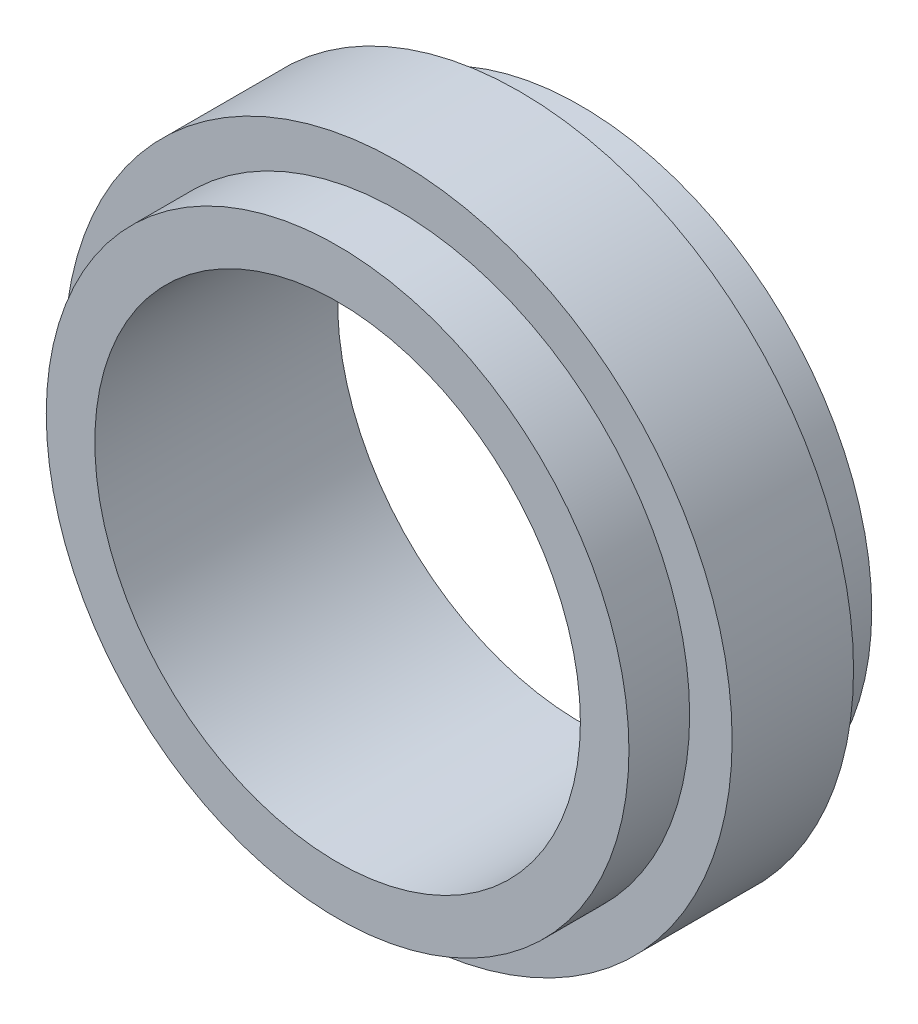
from build123d import *

# Parameters (mm, degrees)
SKETCH1_R           = 27.5
SKETCH1_R_2         = 20
BOSS_EXTRUDE1_DEPTH = 5
SKETCH2_R           = 24
SKETCH2_R_2         = 20
BOSS_EXTRUDE2_DEPTH = 5


with BuildPart() as part:
    # Sketch1 → Boss-Extrude1 (new, symmetric)
    with BuildSketch(Plane.XY):
        Circle(SKETCH1_R)
        Circle(SKETCH1_R_2, mode=Mode.SUBTRACT)
    extrude(amount=BOSS_EXTRUDE1_DEPTH, both=True)

    # Sketch2 → Boss-Extrude2 (add)
    with BuildSketch(Plane.XY.offset(5)):
        Circle(SKETCH2_R)
        Circle(SKETCH2_R_2, mode=Mode.SUBTRACT)
    boss_extrude2 = extrude(amount=BOSS_EXTRUDE2_DEPTH)

    # Mirror1: Boss-Extrude2 across plane
    add(boss_extrude2.mirror(Plane.XY))


solid = part.part
